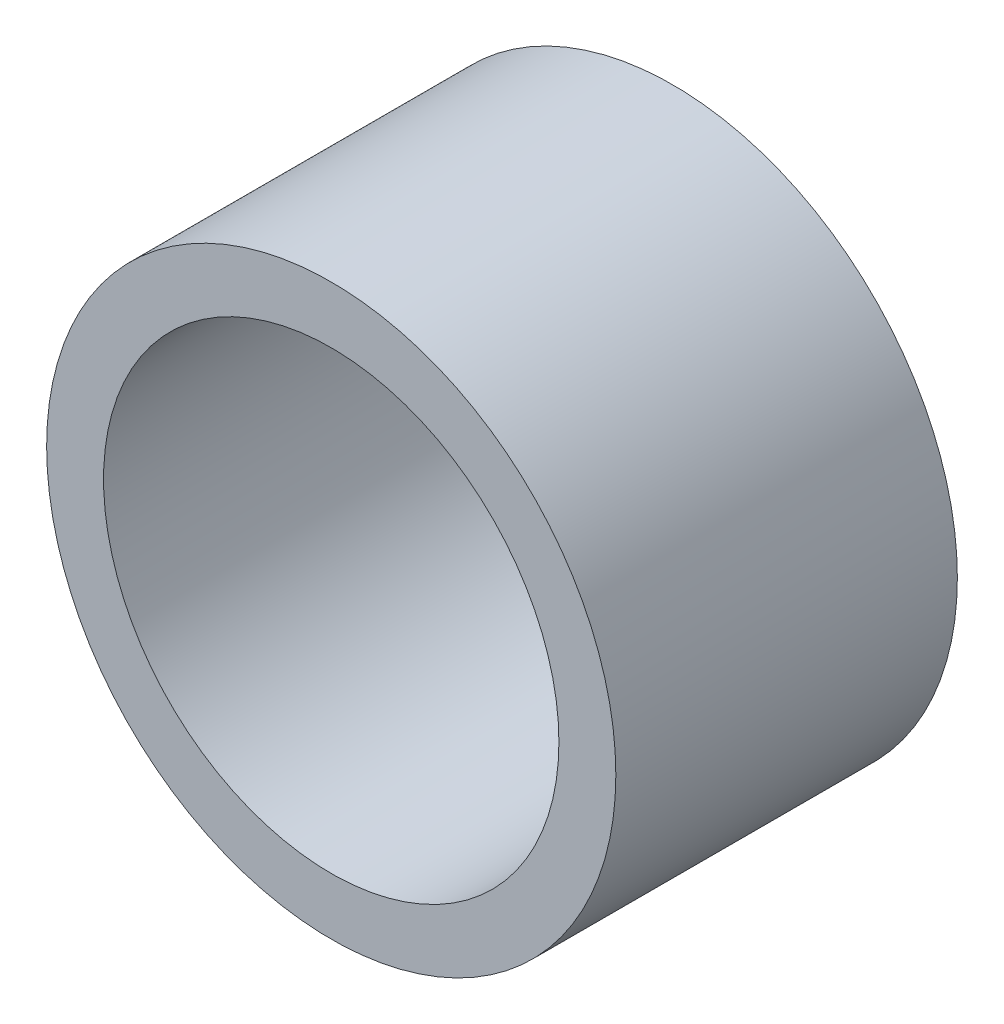
from build123d import *

# Parameters (mm, degrees)
SKETCH_1_R      = 5
SKETCH_1_R_2    = 4
EXTRUDE_1_DEPTH = 6


with BuildPart() as part:
    # 草图1 → 凸台-拉伸1 (new body)
    with BuildSketch(Plane.XY):
        Circle(SKETCH_1_R)
        Circle(SKETCH_1_R_2, mode=Mode.SUBTRACT)
    extrude(amount=EXTRUDE_1_DEPTH)


solid = part.part
